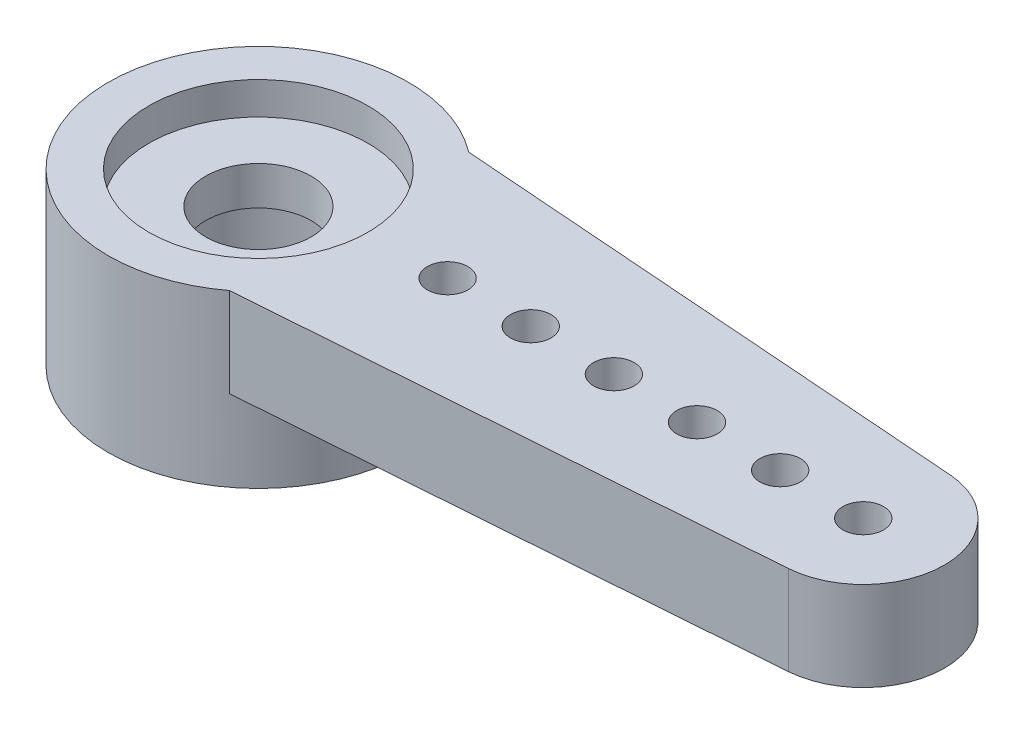
from build123d import *
from build123d.topology import SkipClean

# Parameters (mm, degrees)
BOSS_EXTRUDE1_START = 2.2
BOSS_EXTRUDE1_DEPTH = 2.2


with BuildPart() as part:
    # Sketch2 → Revolve1 (revolve)
    with BuildSketch(Plane.XY, mode=Mode.PRIVATE) as revolve1_sk:
        Polygon((2.7, 2.2), (2.7, 1.4), (1.3, 1.4), (1.3, 0.45), (2.35, 0.45), (2.35, -2), (3.7, -2), (3.7, 2.2), align=None)
    revolve(revolve1_sk.sketch.rotate(Axis((0, 55, 0), (0, -1, 0)), 90), axis=Axis((0, 55, 0), (0, -1, 0)))

    # Sketch3 → Boss-Extrude1 (add)
    with BuildSketch(Plane(origin=(0, 0, 0), x_dir=(1, 0, 0), z_dir=(0, 1, 0)).offset(BOSS_EXTRUDE1_START)):
        with BuildLine():
            ThreePointArc((3.7, 0), (3.313087927, -1.647254803), (2.233271143, -2.95))
            Line((2.233271143, -2.95), (15.04870989, -1.994463679))
            ThreePointArc((15.04870989, -1.994463679), (13.729944749, -1.622026729), (12.960476899, -0.488108738))
            ThreePointArc((12.960476899, -0.488108738), (12.539189082, -0.389998964), (12.35208013, 0))
            Line((12.35208013, 0), (11.304160261, 0))
            ThreePointArc((11.304160261, 0), (10.804160261, -0.5), (10.304160261, 0))
            Line((10.304160261, 0), (9.256240391, 0))
            ThreePointArc((9.256240391, 0), (8.756240391, -0.5), (8.256240391, 0))
            Line((8.256240391, 0), (7.208320521, 0))
            ThreePointArc((7.208320521, 0), (6.708320521, -0.5), (6.208320521, 0))
            Line((6.208320521, 0), (5.160400652, 0))
            ThreePointArc((5.160400652, 0), (4.660400652, -0.5), (4.160400652, 0))
            Line((4.160400652, 0), (3.7, 0))
        make_face()
        with BuildLine():
            ThreePointArc((12.960476899, -0.488108738), (13.729944749, -1.622026729), (15.04870989, -1.994463679))
            ThreePointArc((15.04870989, -1.994463679), (16.36584784, -1.360621222), (16.9, 0))
            Line((16.9, 0), (15.4, 0))
            ThreePointArc((15.4, 0), (14.9, -0.5), (14.4, 0))
            Line((14.4, 0), (13.35208013, 0))
            ThreePointArc((13.35208013, 0), (13.242079095, -0.312891048), (12.960476899, -0.488108738))
        make_face()
    boss_extrude1 = extrude(amount=-BOSS_EXTRUDE1_DEPTH)

    # Mirror1: Boss-Extrude1 across plane
    with SkipClean():  # the faces are left unmerged after this step: merging them gives an invalid solid
        add(boss_extrude1.mirror(Plane(origin=(0, 17.160462404, 0), x_dir=(1, 0, 0), z_dir=(0, 0, -1))))


solid = part.part
